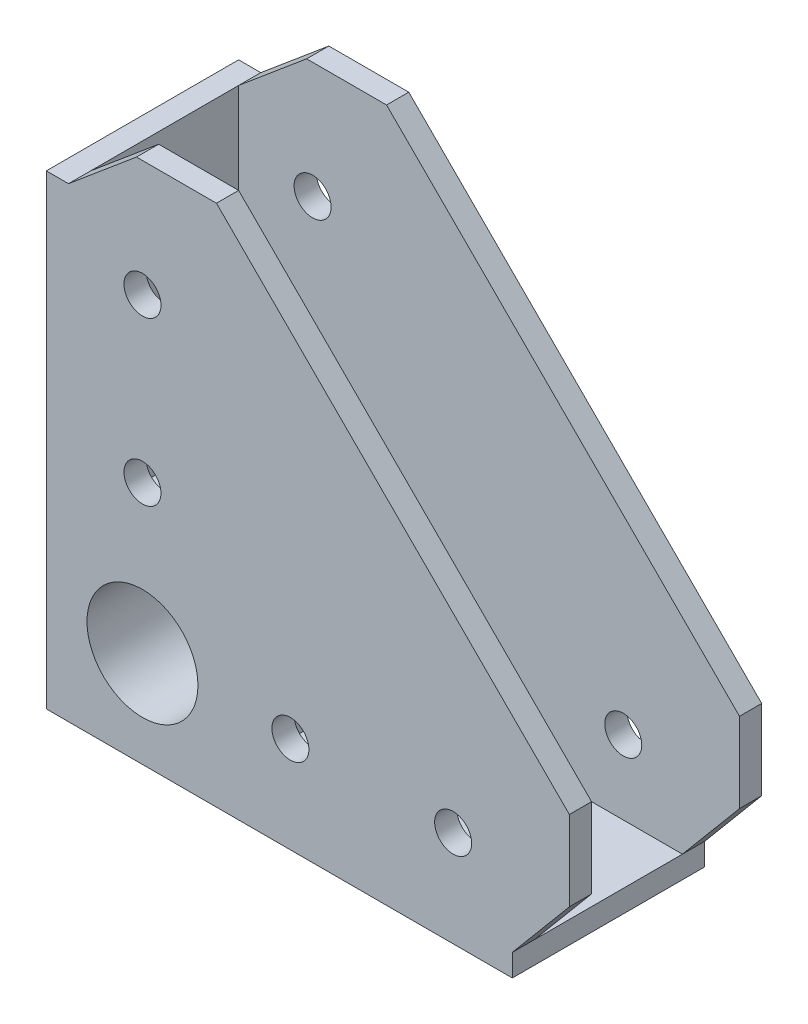
from build123d import *

# Parameters (mm, degrees)
IZIM1_W                     = 20
IZIM1_H                     = 20
Y_KSEKLIK_EKSTR_ZYON1_DEPTH = 20
Y_KSEKLIK_EKSTR_ZYON2_DEPTH = 3
Y_KSEKLIK_EKSTR_ZYON3_DEPTH = 3
IZIM4_W                     = 26
IZIM4_H                     = 60
Y_KSEKLIK_EKSTR_ZYON4_DEPTH = 3
IZIM5_W                     = 63
IZIM5_H                     = 26
Y_KSEKLIK_EKSTR_ZYON5_DEPTH = 3
IZIM6_R                     = 7.5
KES_EKSTR_ZYON1_DEPTH       = 86.660287915
IZIM7_R                     = 2.5
KES_EKSTR_ZYON2_DEPTH       = 50
IZIM8_R                     = 1.924658324
IZIM8_R_2                   = 2.223723329
KES_EKSTR_ZYON3_DEPTH       = 50
IZIM9_R                     = 1.794605822
IZIM9_R_2                   = 1.816429962
KES_EKSTR_ZYON4_DEPTH       = 50


with BuildPart() as part:
    # Çizim1 → Yükseklik-Ekstrüzyon1 (new body)
    with BuildSketch(Plane.XY):
        Rectangle(IZIM1_W, IZIM1_H)
    extrude(amount=Y_KSEKLIK_EKSTR_ZYON1_DEPTH)

    # Çizim2 → Yükseklik-Ekstrüzyon2 (add)
    with BuildSketch(Plane.XY.offset(20)):
        Polygon((-10, -10), (-10, 10), (-10, 50), (-0.807466683, 57.713451316), (10, 57.713451316), (57.713451316, 10), (57.713451316, -0.807466683), (50, -10), (10, -10), align=None)
    extrude(amount=Y_KSEKLIK_EKSTR_ZYON2_DEPTH)

    # Çizim3 → Yükseklik-Ekstrüzyon3 (add)
    with BuildSketch(Plane(origin=(0, 0, 0), x_dir=(-1, 0, 0), z_dir=(0, 0, -1))):
        Polygon((10, -10), (-50, -10), (-57.713451316, -0.807466683), (-57.713451316, 10), (-10, 57.713451316), (0.807466683, 57.713451316), (10, 50), align=None)
    extrude(amount=Y_KSEKLIK_EKSTR_ZYON3_DEPTH)

    # Çizim4 → Yükseklik-Ekstrüzyon4 (add)
    with BuildSketch(Plane.ZY.offset(10)):
        with Locations((10, 20)):
            Rectangle(IZIM4_W, IZIM4_H)
    extrude(amount=Y_KSEKLIK_EKSTR_ZYON4_DEPTH)

    # Çizim5 → Yükseklik-Ekstrüzyon5 (add)
    with BuildSketch(Plane.XZ.offset(10)):
        with Locations((18.5, 10)):
            Rectangle(IZIM5_W, IZIM5_H)
    extrude(amount=Y_KSEKLIK_EKSTR_ZYON5_DEPTH)

    # Çizim6 → Kes-Ekstrüzyon1 (cut, through all)
    with BuildSketch(Plane.XY.offset(23)):
        Circle(IZIM6_R)
    extrude(amount=-KES_EKSTR_ZYON1_DEPTH, mode=Mode.SUBTRACT)

    # Çizim7 → Kes-Ekstrüzyon2 (cut)
    with BuildSketch(Plane(origin=(0, 0, -3), x_dir=(-1, 0, 0), z_dir=(0, 0, -1))):
        with Locations((-20, 0)):
            Circle(IZIM7_R)
        with Locations((-42, 0)):
            Circle(IZIM7_R)
        with Locations((0, 20)):
            Circle(IZIM7_R)
        with Locations((0, 42)):
            Circle(IZIM7_R)
    extrude(amount=-KES_EKSTR_ZYON2_DEPTH, mode=Mode.SUBTRACT)

    # Çizim8 → Kes-Ekstrüzyon3 (cut)
    with BuildSketch(Plane(origin=(-10, 0, 0), x_dir=(0, 0, -1), z_dir=(1, 0, 0))):
        with Locations(Location((-10, 20, 0), (0, 0, 90))):
            Circle(IZIM8_R)
        with Locations(Location((-10, 42, 0), (0, 0, 90))):
            Circle(IZIM8_R_2)
    extrude(amount=-KES_EKSTR_ZYON3_DEPTH, mode=Mode.SUBTRACT)

    # Çizim9 → Kes-Ekstrüzyon4 (cut)
    with BuildSketch(Plane(origin=(0, -10, 0), x_dir=(1, 0, 0), z_dir=(0, 1, 0))):
        with Locations(Location((20, -10, 0), (0, 0, 270))):
            Circle(IZIM9_R)
        with Locations(Location((42, -10, 0), (0, 0, 270))):
            Circle(IZIM9_R_2)
    extrude(amount=-KES_EKSTR_ZYON4_DEPTH, mode=Mode.SUBTRACT)


solid = part.part
